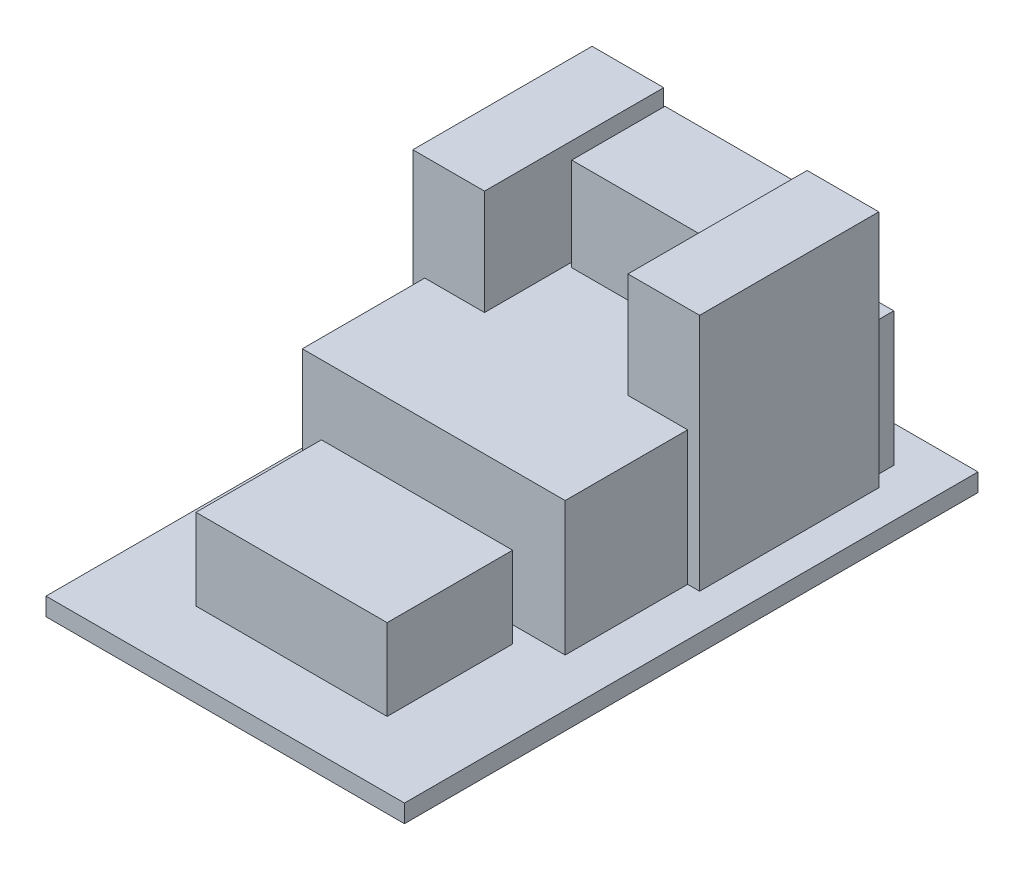
from build123d import *

# Parameters (mm, degrees)
SKETCH_1_W      = 300
SKETCH_1_H      = 480
EXTRUDE_1_DEPTH = 15
SKETCH_2_W      = 220
SKETCH_2_H      = 275
EXTRUDE_2_DEPTH = 112
SKETCH_3_W      = 160
SKETCH_3_H      = 105
EXTRUDE_3_DEPTH = 68
SKETCH_4_W      = 60
SKETCH_4_H      = 150
EXTRUDE_4_DEPTH = 200
SKETCH_5_W      = 60
SKETCH_5_H      = 150
EXTRUDE_5_DEPTH = 200
SKETCH_6_W      = 112
SKETCH_6_H      = 78
EXTRUDE_6_DEPTH = 190


with BuildPart() as part:
    # 草图1 → 凸台-拉伸1 (new body)
    with BuildSketch(Plane(origin=(0, 0, 0), x_dir=(1, 0, 0), z_dir=(0, 1, 0))):
        Rectangle(SKETCH_1_W, SKETCH_1_H)
    extrude(amount=-EXTRUDE_1_DEPTH)

    # 草图2 → 凸台-拉伸2 (add)
    with BuildSketch(Plane(origin=(0, 0, 0), x_dir=(1, 0, 0), z_dir=(0, 1, 0))):
        with Locations((0, 72)):
            Rectangle(SKETCH_2_W, SKETCH_2_H)
    extrude(amount=EXTRUDE_2_DEPTH)

    # 草图3 → 凸台-拉伸3 (add)
    with BuildSketch(Plane(origin=(0, 0, 0), x_dir=(1, 0, 0), z_dir=(0, 1, 0))):
        with Locations((0, -132)):
            Rectangle(SKETCH_3_W, SKETCH_3_H)
    extrude(amount=EXTRUDE_3_DEPTH)

    # 草图4 → 凸台-拉伸4 (add)
    with BuildSketch(Plane(origin=(0, 0, 0), x_dir=(1, 0, 0), z_dir=(0, 1, 0))):
        with Locations((-90, 112)):
            Rectangle(SKETCH_4_W, SKETCH_4_H)
    extrude(amount=EXTRUDE_4_DEPTH)

    # 草图5 → 凸台-拉伸5 (add)
    with BuildSketch(Plane(origin=(0, 0, 0), x_dir=(1, 0, 0), z_dir=(0, 1, 0))):
        with Locations((90, 112)):
            Rectangle(SKETCH_5_W, SKETCH_5_H)
    extrude(amount=EXTRUDE_5_DEPTH)

    # 草图6 → 凸台-拉伸6 (add)
    with BuildSketch(Plane(origin=(0, 0, 0), x_dir=(1, 0, 0), z_dir=(0, 1, 0))):
        with Locations((0, 145)):
            Rectangle(SKETCH_6_W, SKETCH_6_H)
    extrude(amount=EXTRUDE_6_DEPTH)


solid = part.part
